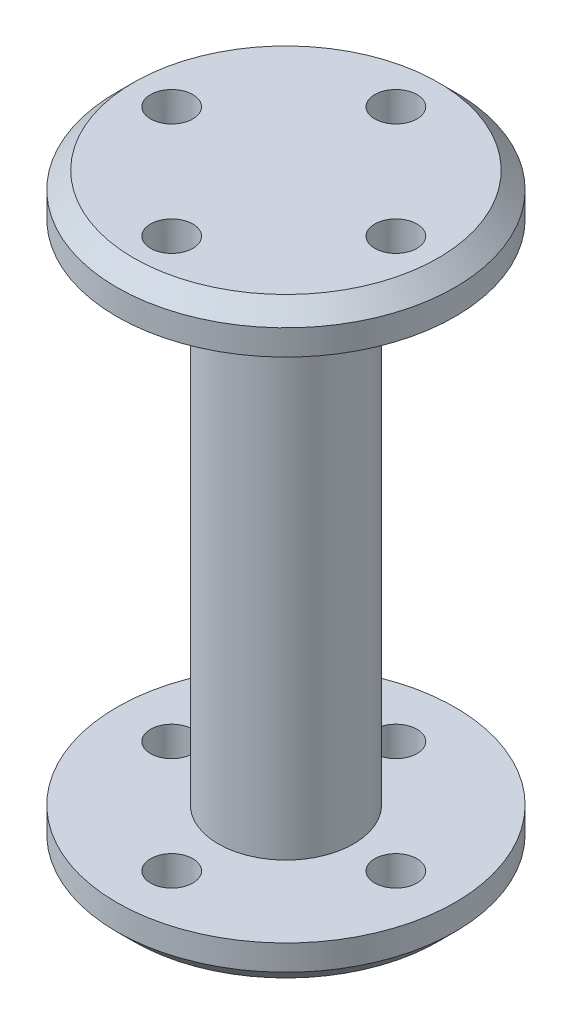
from build123d import *

# Parameters (mm, degrees)
SKETCH1_R           = 8
BOSS_EXTRUDE1_DEPTH = 30
SKETCH2_R           = 20
BOSS_EXTRUDE2_DEPTH = 5
CHAMFER1_SIZE       = 2
SKETCH3_R           = 2.5
CUT_EXTRUDE1_DEPTH  = 71.887234394
CIRPATTERN1_COUNT   = 4


with BuildPart() as part:
    # Sketch1 → Boss-Extrude1 (new, symmetric)
    with BuildSketch(Plane(origin=(0, 0, 0), x_dir=(1, 0, 0), z_dir=(0, 1, 0))):
        with Locations(Location((0, 0, 0), (0, 0, 270))):
            Circle(SKETCH1_R)
    extrude(amount=BOSS_EXTRUDE1_DEPTH, both=True)

    # Sketch2 → Boss-Extrude2 (add)
    with BuildSketch(Plane(origin=(0, 30, 0), x_dir=(1, 0, 0), z_dir=(0, 1, 0))):
        with Locations(Location((0, 0, 0), (0, 0, 270))):
            Circle(SKETCH2_R)
    extrude(amount=BOSS_EXTRUDE2_DEPTH)

    # Chamfer1
    chamfer1_edges = [part.edges().sort_by_distance(p)[0] for p in [
        (0, 35, -20),
    ]]
    chamfer(chamfer1_edges, length=CHAMFER1_SIZE)

    # Sketch3 → Cut-Extrude1 (cut, through all)
    with BuildSketch(Plane(origin=(0, 35, 0), x_dir=(1, 0, 0), z_dir=(0, 1, 0))):
        with Locations(Location((0, 13, 0), (0, 0, 270))):
            Circle(SKETCH3_R)
    cut_extrude1 = extrude(amount=-CUT_EXTRUDE1_DEPTH, mode=Mode.SUBTRACT)

    # CirPattern1: Cut-Extrude1 ×4 about axis
    cirpattern1_axis = Axis((0, 0, 0.25570417), (0, 1, 0))
    for i in range(1, CIRPATTERN1_COUNT):
        add(cut_extrude1.rotate(cirpattern1_axis, i * 360 / CIRPATTERN1_COUNT), mode=Mode.SUBTRACT)

    # Mirror1: part across plane


with BuildPart() as part_1:
    add(part.part)
    add(part.part.mirror(Plane.ZX))


solid = part_1.part
